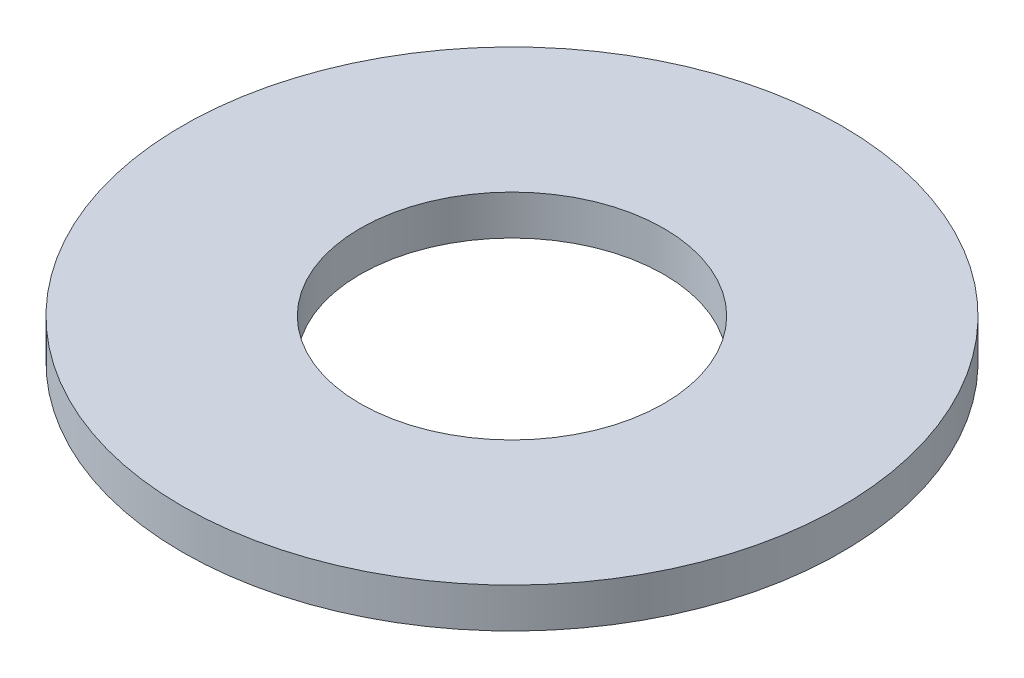
from build123d import *

# Parameters (mm, degrees)
SKETCH2_W = 4.8768
SKETCH2_H = 1.0922


with BuildPart() as part:
    # Sketch2 → Revolve1 (revolve)
    with BuildSketch(Plane(origin=(0, 0, 0), x_dir=(0, 0, -1), z_dir=(1, 0, 0))):
        with Locations((6.604, 0.5461)):
            Rectangle(SKETCH2_W, SKETCH2_H)
    revolve(axis=Axis((0, -1000, 0), (0, 1, 0)))


solid = part.part
